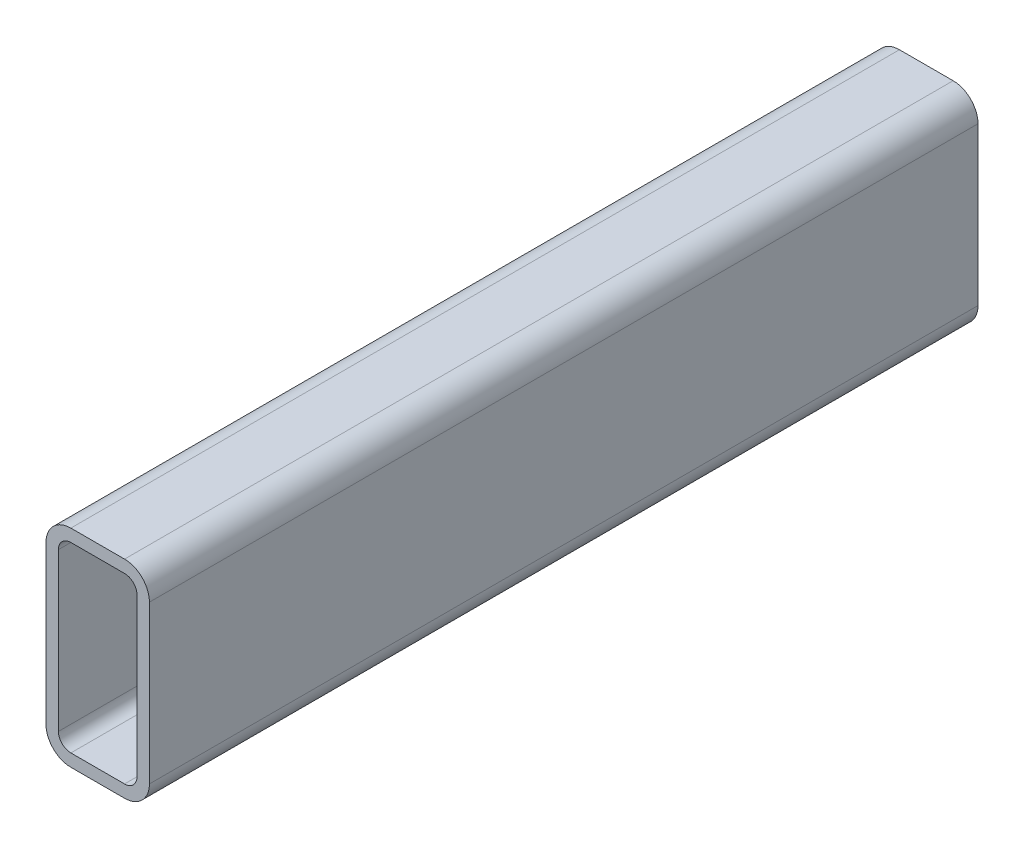
from build123d import *

# Parameters (mm, degrees)
BOSS_EXTRUDE1_DEPTH = 200


with BuildPart() as part:
    # Sketch1 → Boss-Extrude1 (new body)
    with BuildSketch(Plane.XY):
        with BuildLine():
            Line((0, 44), (0, 6))
            ThreePointArc((0, 6), (1.757359313, 1.757359313), (6, 0))
            Line((6, 0), (18.96119643, 0))
            ThreePointArc((18.96119643, 0), (23.203837117, 1.757359313), (24.96119643, 6))
            Line((24.96119643, 6), (24.96119643, 44))
            ThreePointArc((24.96119643, 44), (23.203837117, 48.242640687), (18.96119643, 50))
            Line((18.96119643, 50), (6, 50))
            ThreePointArc((6, 50), (1.757359313, 48.242640687), (0, 44))
        make_face()
        with BuildLine():
            Line((3, 44), (3, 6))
            ThreePointArc((3, 6), (3.878679656, 3.878679656), (6, 3))
            Line((6, 3), (18.96119643, 3))
            ThreePointArc((18.96119643, 3), (21.082516774, 3.878679656), (21.96119643, 6))
            Line((21.96119643, 6), (21.96119643, 44))
            ThreePointArc((21.96119643, 44), (21.082516774, 46.121320344), (18.96119643, 47))
            Line((18.96119643, 47), (6, 47))
            ThreePointArc((6, 47), (3.878679656, 46.121320344), (3, 44))
        make_face(mode=Mode.SUBTRACT)
    extrude(amount=BOSS_EXTRUDE1_DEPTH)


solid = part.part
